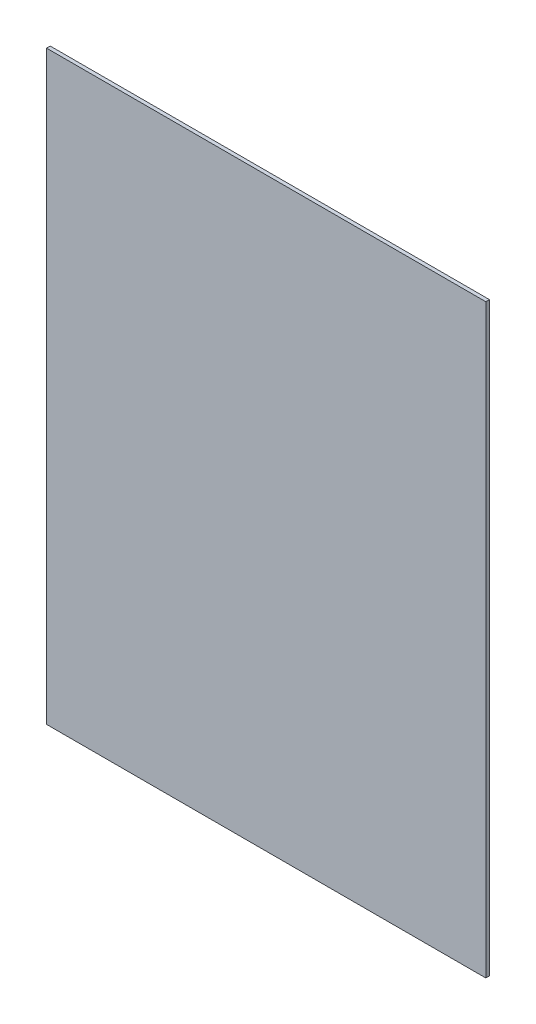
from build123d import *

# Parameters (mm, degrees)
SZKIC1_W                    = 600
SZKIC1_H                    = 800
DODANIE_WYCI_GNI_CIE1_DEPTH = 5


with BuildPart() as part:
    # Szkic1 → Dodanie-wyciągnięcie1 (new body)
    with BuildSketch(Plane.XY):
        with Locations((300, 400)):
            Rectangle(SZKIC1_W, SZKIC1_H)
    extrude(amount=DODANIE_WYCI_GNI_CIE1_DEPTH)


solid = part.part
